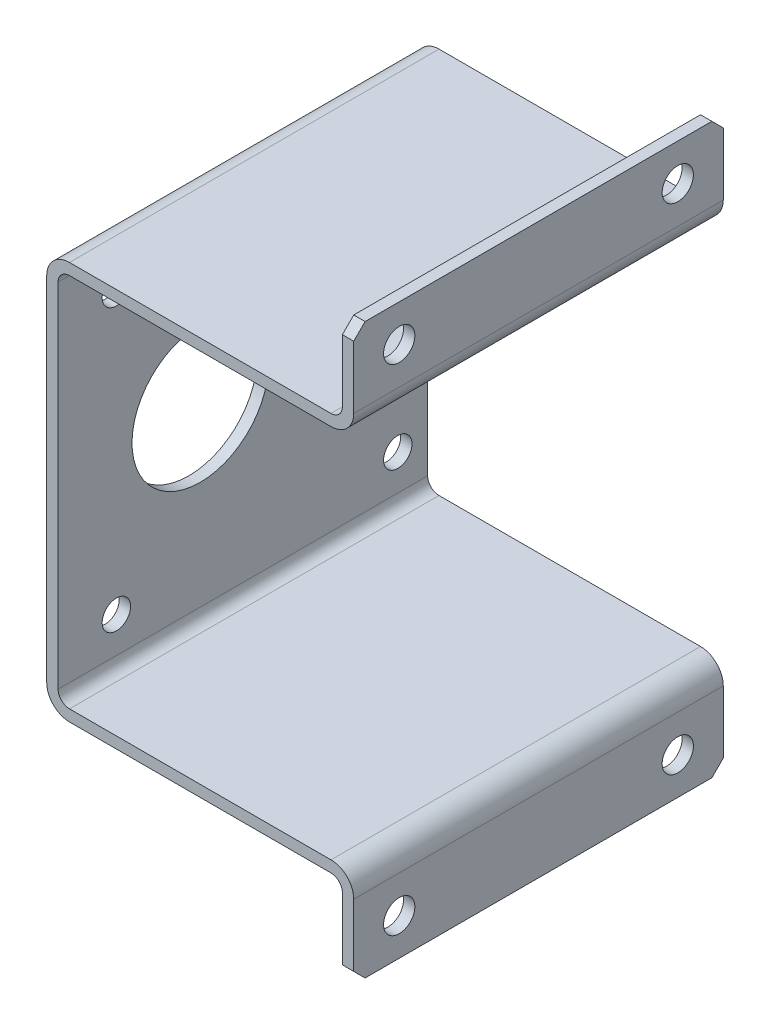
from build123d import *

# Parameters (mm, degrees)
BOSS_EXTRUDE1_DEPTH        = 65
SKETCH2_R                  = 12
CUT_EXTRUDE1_DEPTH         = 99.188594042
F_5_5_5_5_DIAMETER_HOLE1_D = 5.5
F_5_0_5_DIAMETER_HOLE1_D   = 5
CHAMFER1_SIZE              = 2
FILLET1_R                  = 4
FILLET2_R                  = 2


with BuildPart() as part:
    # Sketch1 → Boss-Extrude1 (new body)
    with BuildSketch(Plane.XY):
        Polygon((0, -33), (0, -50), (-2, -50), (-2, -35), (-54, -35), (-54, 35), (-2, 35), (-2, 50), (0, 50), (0, 33), (-52, 33), (-52, -33), align=None)
    extrude(amount=BOSS_EXTRUDE1_DEPTH)

    # Sketch2 → Cut-Extrude1 (cut, through all)
    with BuildSketch(Plane.ZY.offset(54)):
        with Locations(Location((40, 0, 0), (0, 0, 270))):
            Circle(SKETCH2_R)
    extrude(amount=-CUT_EXTRUDE1_DEPTH, mode=Mode.SUBTRACT)

    # Ø5.5 (5.5) Diameter Hole1 (through all)
    with Locations(Plane.ZY.offset(2)):
        with Locations((57, -43.5), (8, -43.5), (57, 43.5), (8, 43.5)):
            Hole(F_5_5_5_5_DIAMETER_HOLE1_D / 2)

    # Ø5.0 (5) Diameter Hole1 (through all)
    with Locations(Plane.ZY.offset(54)):
        with Locations((54.748737342, 24.748737342), (54.748737342, -24.748737342), (5.251262658, -24.748737342), (5.251262658, 24.748737342)):
            Hole(F_5_0_5_DIAMETER_HOLE1_D / 2)

    # Chamfer1
    chamfer1_edges = [part.edges().sort_by_distance(p)[0] for p in [
        (-1, 50, 0),
        (-1, -50, 0),
        (-1, 50, 65),
        (-1, -50, 65),
    ]]
    chamfer(chamfer1_edges, length=CHAMFER1_SIZE)

    # Fillet1
    fillet1_edges = [part.edges().sort_by_distance(p)[0] for p in [
        (-54, -35, 32.5),
        (-54, 35, 32.5),
        (0, 33, 32.5),
        (0, -33, 32.5),
    ]]
    fillet(fillet1_edges, radius=FILLET1_R)

    # Fillet2
    fillet2_edges = [part.edges().sort_by_distance(p)[0] for p in [
        (-2, -35, 32.5),
        (-2, 35, 32.5),
        (-52, 33, 32.5),
        (-52, -33, 32.5),
    ]]
    fillet(fillet2_edges, radius=FILLET2_R)


solid = part.part
